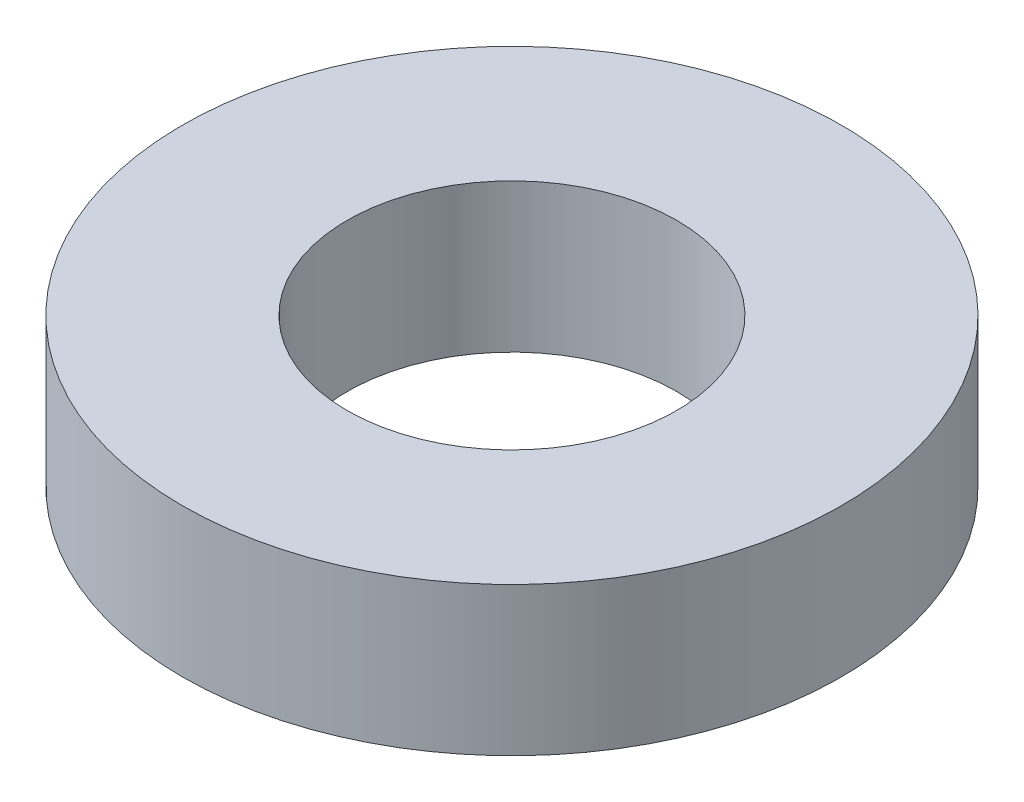
from build123d import *

# Parameters (mm, degrees)
SKETCH1_R           = 40
SKETCH1_R_2         = 20
BOSS_EXTRUDE1_DEPTH = 18


with BuildPart() as part:
    # Sketch1 → Boss-Extrude1 (new body)
    with BuildSketch(Plane(origin=(0, 0, 0), x_dir=(1, 0, 0), z_dir=(0, 1, 0))):
        with Locations(Location((0, 0, 0), (0, 0, 270))):
            Circle(SKETCH1_R)
        with Locations(Location((0, 0, 0), (0, 0, 270))):
            Circle(SKETCH1_R_2, mode=Mode.SUBTRACT)
    extrude(amount=BOSS_EXTRUDE1_DEPTH)


solid = part.part
